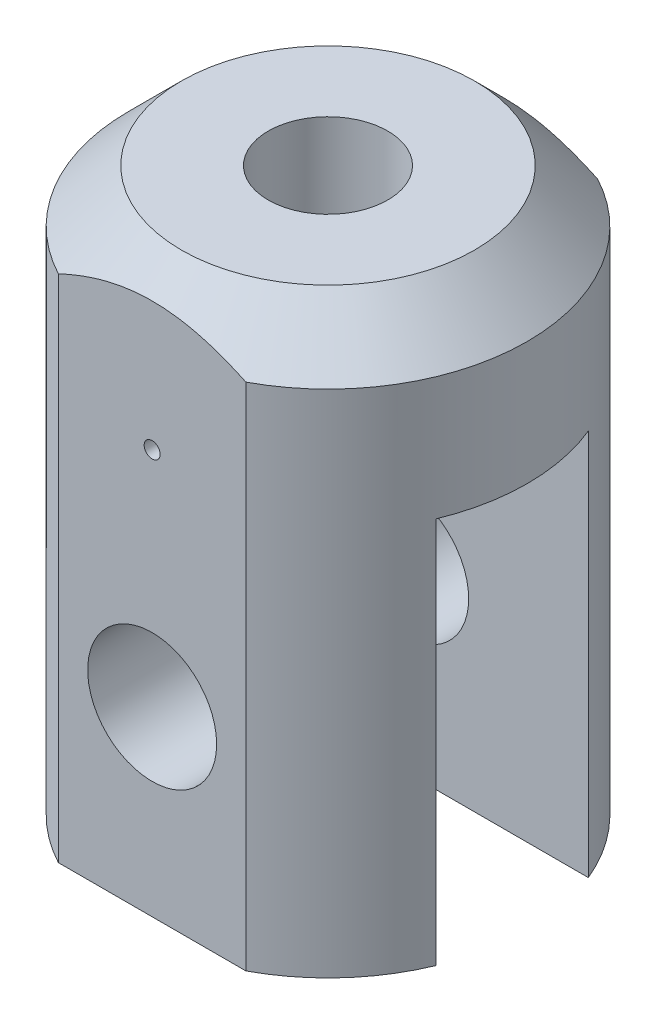
from build123d import *

# Parameters (mm, degrees)
SKETCH_1_R          = 85
EXTRUDE_1_DEPTH     = 240
SKETCH_2_W          = 162
SKETCH_2_H          = 14
CUT_EXTRUDE_1_DEPTH = 269.421310629
SKETCH_5_W          = 188
SKETCH_5_H          = 65
CUT_EXTRUDE_2_DEPTH = 165
SKETCH_6_R          = 27.5
CUT_EXTRUDE_3_DEPTH = 296.508037116
SKETCH_6_3_R        = 3.4
CUT_EXTRUDE_4_DEPTH = 20
CUT_EXTRUDE_5_REACH = 267.424
SKETCH_8_R          = 25.5


with BuildPart() as part:
    # 草图1 → 凸台-拉伸1 (new body)
    with BuildSketch(Plane(origin=(0, 0, 0), x_dir=(1, 0, 0), z_dir=(0, 1, 0))):
        Circle(SKETCH_1_R)
    extrude(amount=-EXTRUDE_1_DEPTH)

    # 草图2 → 切除-拉伸1 (cut, through all)
    with BuildSketch(Plane(origin=(0, 0, 0), x_dir=(1, 0, 0), z_dir=(0, 1, 0))):
        with Locations((1.586849721, 82)):
            Rectangle(SKETCH_2_W, SKETCH_2_H)
    cut_extrude_1 = extrude(amount=-CUT_EXTRUDE_1_DEPTH, mode=Mode.SUBTRACT)

    # 镜向1: 切除-拉伸1 across plane
    add(cut_extrude_1.mirror(Plane.XY), mode=Mode.SUBTRACT)

    # 草图3 → 切除-旋转1 (revolve, cut)
    with BuildSketch(Plane.XY):
        Polygon((85, -22.5), (62.5, 0), (85, 0), align=None)
    revolve(axis=Axis((0, -240, 0), (0, 1, 0)), mode=Mode.SUBTRACT)

    # 草图5 → 切除-拉伸2 (cut)
    with BuildSketch(Plane.XZ.offset(240)):
        Rectangle(SKETCH_5_W, SKETCH_5_H)
    extrude(amount=-CUT_EXTRUDE_2_DEPTH, mode=Mode.SUBTRACT)

    # 草图6 → 切除-拉伸3 (cut, through all)
    with BuildSketch(Plane.XY.offset(75)):
        with Locations((0, -162.5)):
            Circle(SKETCH_6_R)
    extrude(amount=-CUT_EXTRUDE_3_DEPTH, mode=Mode.SUBTRACT)

    # 草图6<3> → 切除-拉伸4 (cut)
    with BuildSketch(Plane.XY.offset(75)):
        with Locations((0, -67.5)):
            Circle(SKETCH_6_3_R)
    extrude(amount=-CUT_EXTRUDE_4_DEPTH, mode=Mode.SUBTRACT)

    # 草图8 → 切除-拉伸5 (cut, up to next)
    with BuildSketch(Plane(origin=(0, 0, 0), x_dir=(1, 0, 0), z_dir=(0, 1, 0)), mode=Mode.PRIVATE) as cut_extrude_5_sk1:
        Circle(SKETCH_8_R)
    cut_extrude_5_tool1 = extrude(cut_extrude_5_sk1.sketch, amount=-CUT_EXTRUDE_5_REACH, mode=Mode.PRIVATE) & part.part
    add(cut_extrude_5_tool1.solids().sort_by_distance((0, 0, 0))[0], mode=Mode.SUBTRACT)


solid = part.part
